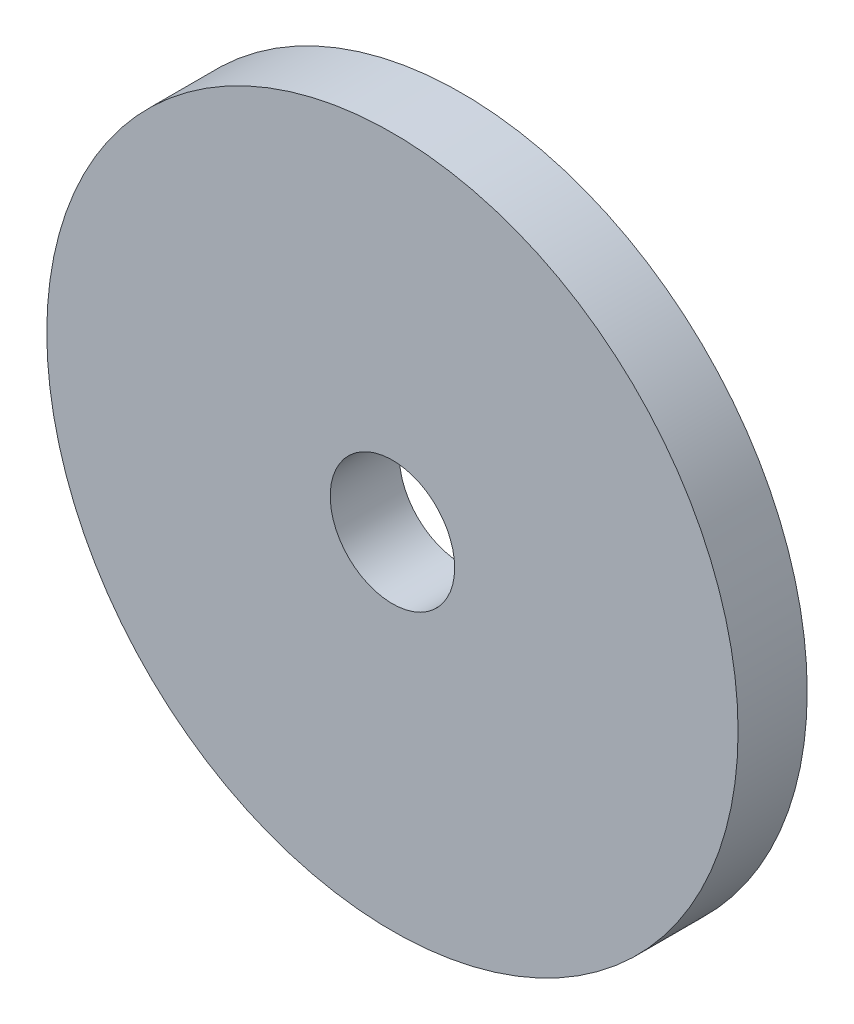
from build123d import *

# Parameters (mm, degrees)
SKETCH_1_R      = 25
SKETCH_1_R_2    = 4.5
EXTRUDE_1_DEPTH = 5


with BuildPart() as part:
    # Эскиз1 → Бобышка-Вытянуть1 (new body)
    with BuildSketch(Plane.XY):
        Circle(SKETCH_1_R)
        Circle(SKETCH_1_R_2, mode=Mode.SUBTRACT)
    extrude(amount=EXTRUDE_1_DEPTH)


solid = part.part
